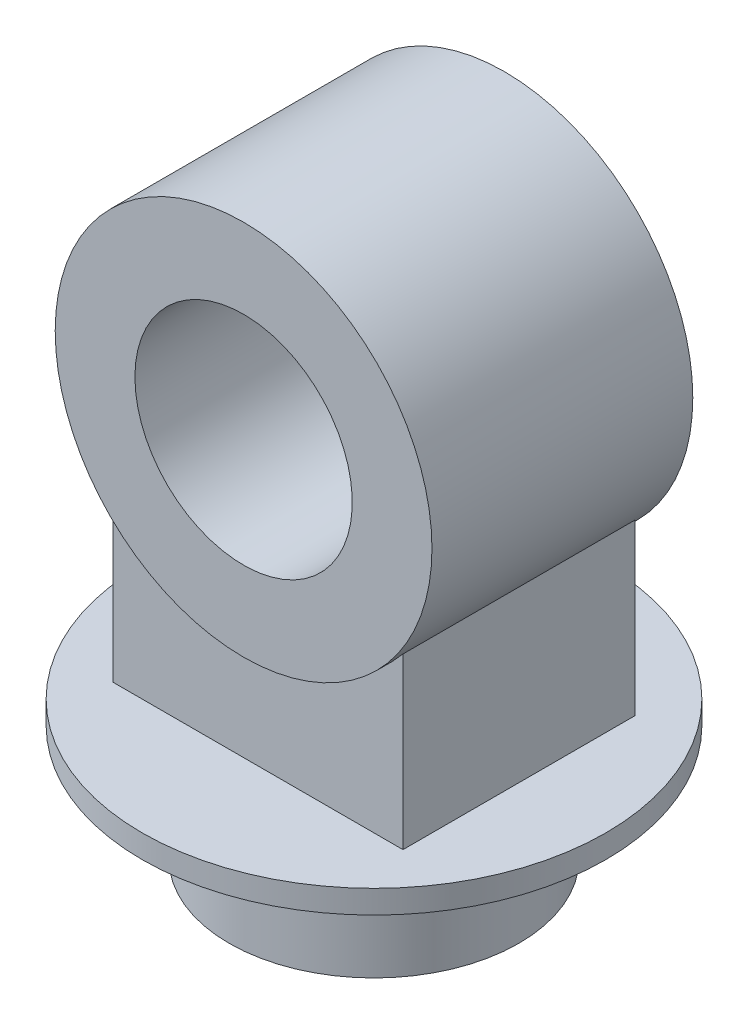
from build123d import *

# Parameters (mm, degrees)
SKETCH1_R                = 100
BOSS_EXTRUDE1_DEPTH      = 80
SKETCH2_R                = 160
BOSS_EXTRUDE2_DEPTH      = 16
SKETCH3_R                = 130
SKETCH3_R_2              = 75
BOSS_EXTRUDE3_DEPTH      = 90
BOSS_EXTRUDE4_REACH      = 402.125
BOSS_EXTRUDE4_END_RADIUS = 130
SKETCH6_W                = 200
SKETCH6_H                = 160


with BuildPart() as part:
    # Sketch1 → Boss-Extrude1 (new body)
    with BuildSketch(Plane(origin=(0, 0, 0), x_dir=(1, 0, 0), z_dir=(0, 1, 0))):
        with Locations(Location((0, 0, 0), (0, 0, 270))):
            Circle(SKETCH1_R)
    extrude(amount=BOSS_EXTRUDE1_DEPTH)

    # Sketch2 → Boss-Extrude2 (add)
    with BuildSketch(Plane(origin=(0, 80, 0), x_dir=(1, 0, 0), z_dir=(0, 1, 0))):
        with Locations(Location((0, 0, 0), (0, 0, 270))):
            Circle(SKETCH2_R)
    extrude(amount=BOSS_EXTRUDE2_DEPTH)



with BuildPart() as body_2:
    # Sketch3 → Boss-Extrude3 (new, symmetric)
    with BuildSketch(Plane.XY):
        with Locations(Location((0, 296, 0), (0, 0, 180))):
            Circle(SKETCH3_R)
        with Locations(Location((0, 296, 0), (0, 0, 180))):
            Circle(SKETCH3_R_2, mode=Mode.SUBTRACT)
    extrude(amount=BOSS_EXTRUDE3_DEPTH, both=True)


with BuildPart() as part_1:
    add(part.part)

    add(body_2.part)  # Boss-Extrude4 merges body 2
    # Boss-Extrude4: up to this cylinder (the profile starts outside it)
    boss_extrude4_end = Plane(origin=(0, 296, 0), z_dir=(0, 0, -1)) * Cylinder(BOSS_EXTRUDE4_END_RADIUS, 1065.25, mode=Mode.PRIVATE)
    # Sketch6 → Boss-Extrude4 (add, up to the surface)
    with BuildSketch(Plane(origin=(0, 96, 0), x_dir=(1, 0, 0), z_dir=(0, 1, 0)), mode=Mode.PRIVATE) as boss_extrude4_sk1:
        Rectangle(SKETCH6_W, SKETCH6_H)
    boss_extrude4_tool1 = extrude(boss_extrude4_sk1.sketch, amount=BOSS_EXTRUDE4_REACH, mode=Mode.PRIVATE) - boss_extrude4_end
    add(boss_extrude4_tool1.solids().sort_by_distance((0, 96, 0))[0])


solid = part_1.part
